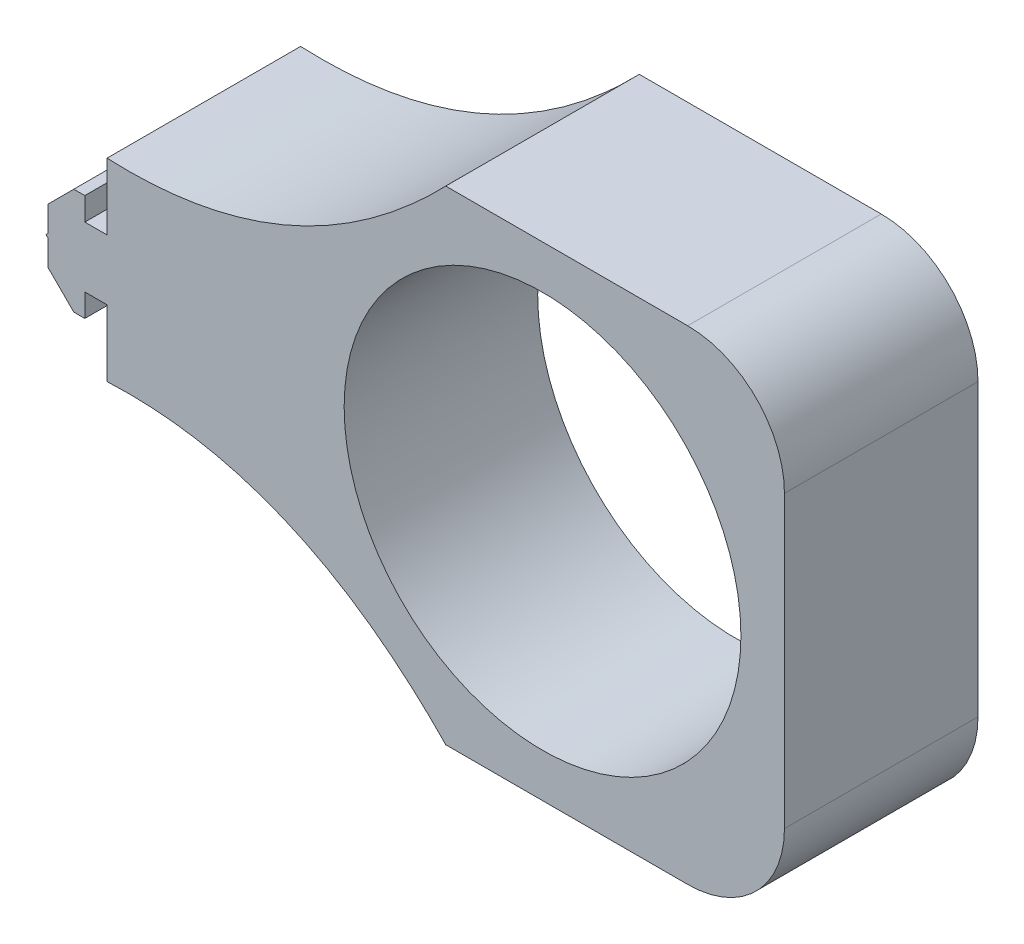
from build123d import *

# Parameters (mm, degrees)
SKETCH1_W           = 50
SKETCH1_H           = 50
SKETCH1_R           = 20.5
BOSS_EXTRUDE1_DEPTH = 20
SKETCH2_W           = 20
SKETCH2_H           = 50
BOSS_EXTRUDE2_DEPTH = 20
CUT_EXTRUDE1_DEPTH  = 20
BOSS_EXTRUDE3_DEPTH = 20
FILLET1_R           = 10


with BuildPart() as part:
    # Sketch1 → Boss-Extrude1 (new body)
    with BuildSketch(Plane.XY):
        Rectangle(SKETCH1_W, SKETCH1_H)
        Circle(SKETCH1_R, mode=Mode.SUBTRACT)
    extrude(amount=BOSS_EXTRUDE1_DEPTH)

    # Sketch2 → Boss-Extrude2 (add)
    with BuildSketch(Plane.ZY.offset(25)):
        with Locations((10, 0)):
            Rectangle(SKETCH2_W, SKETCH2_H)
    extrude(amount=BOSS_EXTRUDE2_DEPTH)

    # Sketch3 → Cut-Extrude1 (cut)
    with BuildSketch(Plane.XY.offset(20)):
        with BuildLine():
            Line((-45, 25), (-45, 10))
            add(Edge.make_bspline(
                [(-45, 10), (-25.372837907, 9.072160547), (-10, 25)],
                knots=[0, 0, 0, 1, 1, 1], degree=2))
            Line((-10, 25), (-45, 25))
        make_face()
        with BuildLine():
            add(Edge.make_bspline(
                [(-45, -10), (-25.372837907, -9.072160547), (-10, -25)],
                knots=[0, 0, 0, 1, 1, 1], degree=2))
            Line((-45, -10), (-45, -25))
            Line((-45, -25), (-10, -25))
        make_face()
    extrude(amount=-CUT_EXTRUDE1_DEPTH, mode=Mode.SUBTRACT)

    # Sketch4 → Boss-Extrude3 (add)
    with BuildSketch(Plane.XY.offset(20)):
        Polygon((-46.455, -3.125), (-45, -3.125), (-45, 3.125), (-46.455, 3.125), (-46.8, 3.125), (-47.3, 3.125), (-47.3, 5.5), (-48.439339828, 5.5), (-51.1, 2.839339828), (-51.1, 0.21), (-51.31, 0), (-51.1, -0.21), (-51.1, -2.839339828), (-48.439339828, -5.5), (-47.3, -5.5), (-47.3, -3.125), (-46.8, -3.125), align=None)
    extrude(amount=-BOSS_EXTRUDE3_DEPTH)

    # Fillet1
    fillet1_edges = [part.edges().sort_by_distance(p)[0] for p in [
        (25, -25, 10),
        (25, 25, 10),
    ]]
    fillet(fillet1_edges, radius=FILLET1_R)


solid = part.part
